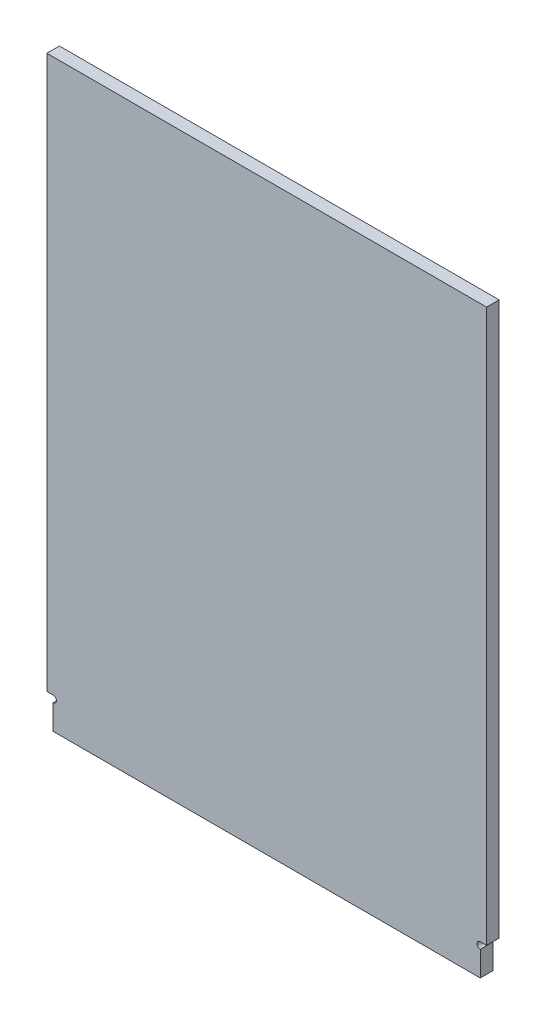
from build123d import *

# Parameters (mm, degrees)
SKETCH1_W           = 444.5
SKETCH1_H           = 609.6
BOSS_EXTRUDE1_DEPTH = 12.7
CUT_EXTRUDE1_DEPTH  = 378.437931984
LPATTERN1_COUNT     = 8
LPATTERN1_PITCH     = 50.8
SKETCH3_R           = 3.302
SKETCH3_W           = 6.35
SKETCH3_H           = 38.1
CUT_EXTRUDE2_DEPTH  = 378.437931984
SKETCH4_W           = 444.5
SKETCH4_H           = 12.7
CUT_EXTRUDE3_DEPTH  = 378.437931984
SKETCH5_W           = 444.5
SKETCH5_H           = 18.431928634
BOSS_EXTRUDE2_DEPTH = 12.7
SKETCH7_W           = 444.5
SKETCH7_H           = 12.7
CUT_EXTRUDE5_DEPTH  = 6.35


with BuildPart() as part:
    # Sketch1 → Boss-Extrude1 (new body)
    with BuildSketch(Plane.XY):
        Rectangle(SKETCH1_W, SKETCH1_H)
    extrude(amount=BOSS_EXTRUDE1_DEPTH)

    # Sketch2 → Cut-Extrude1 (cut, through all)
    with BuildSketch(Plane.XY.offset(12.7)):
        with BuildLine():
            Line((-165.1, 304.8), (-190.5, 304.8))
            Line((-190.5, 304.8), (-190.5, 292.1))
            ThreePointArc((-190.5, 292.1), (-187.198, 295.402), (-183.896, 292.1))
            Line((-183.896, 292.1), (-171.704, 292.1))
            ThreePointArc((-171.704, 292.1), (-168.402, 295.402), (-165.1, 292.1))
            Line((-165.1, 292.1), (-165.1, 304.8))
        make_face()
        with BuildLine():
            ThreePointArc((-183.896, 292.1), (-187.198, 295.402), (-190.5, 292.1))
            Line((-190.5, 292.1), (-183.896, 292.1))
        make_face()
        with BuildLine():
            Line((-183.896, 292.1), (-190.5, 292.1))
            ThreePointArc((-190.5, 292.1), (-187.198, 288.798), (-183.896, 292.1))
        make_face()
        with BuildLine():
            ThreePointArc((-171.704, 292.1), (-168.402, 288.798), (-165.1, 292.1))
            Line((-165.1, 292.1), (-171.704, 292.1))
        make_face()
        with BuildLine():
            Line((-171.704, 292.1), (-165.1, 292.1))
            ThreePointArc((-165.1, 292.1), (-168.402, 295.402), (-171.704, 292.1))
        make_face()
    cut_extrude1 = extrude(amount=-CUT_EXTRUDE1_DEPTH, mode=Mode.SUBTRACT)

    # LPattern1: Cut-Extrude1 ×8
    with Locations(*[(i * LPATTERN1_PITCH, 0, 0) for i in range(1, LPATTERN1_COUNT)]):
        add(cut_extrude1, mode=Mode.SUBTRACT)

    # Sketch3 → Cut-Extrude2 (cut, through all)
    with BuildSketch(Plane.XY.offset(12.7)):
        with Locations((-215.9, -270.002)):
            Circle(SKETCH3_R)
        with Locations((-219.075, -285.75)):
            Rectangle(SKETCH3_W, SKETCH3_H)
    cut_extrude2 = extrude(amount=-CUT_EXTRUDE2_DEPTH, mode=Mode.SUBTRACT)

    # Mirror3: Cut-Extrude2 across plane
    add(cut_extrude2.mirror(Plane(origin=(0, 0, 0), x_dir=(0, 0, 1), z_dir=(1, 0, 0))), mode=Mode.SUBTRACT)

    # Sketch4 → Cut-Extrude3 (cut, through all)
    with BuildSketch(Plane.XY.offset(12.7)):
        with Locations((0, 298.45)):
            Rectangle(SKETCH4_W, SKETCH4_H)
    extrude(amount=-CUT_EXTRUDE3_DEPTH, mode=Mode.SUBTRACT)

    # Sketch5 → Boss-Extrude2 (add)
    with BuildSketch(Plane.XY.offset(12.7)):
        with Locations((0, 282.884035683)):
            Rectangle(SKETCH5_W, SKETCH5_H)
    extrude(amount=-BOSS_EXTRUDE2_DEPTH)

    # Sketch7 → Cut-Extrude5 (cut)
    with BuildSketch(Plane.XZ.offset(304.8)):
        with Locations((0, 6.35)):
            Rectangle(SKETCH7_W, SKETCH7_H)
    extrude(amount=-CUT_EXTRUDE5_DEPTH, mode=Mode.SUBTRACT)


solid = part.part
